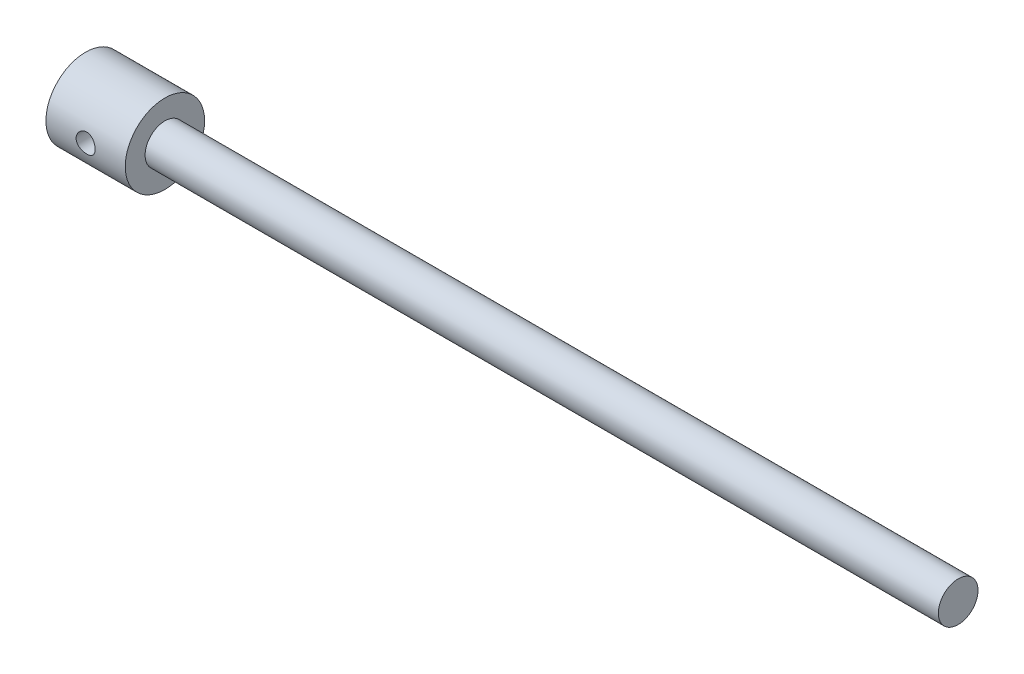
from build123d import *

# Parameters (mm, degrees)
SKETCH1_R           = 25
BOSS_EXTRUDE1_DEPTH = 50
SKETCH2_R           = 6
CUT_EXTRUDE1_DEPTH  = 35
SKETCH3_R           = 12.5
BOSS_EXTRUDE2_DEPTH = 500


with BuildPart() as part:
    # Sketch1 → Boss-Extrude1 (new body)
    with BuildSketch(Plane(origin=(0, 0, 0), x_dir=(0, 0, -1), z_dir=(1, 0, 0))):
        Circle(SKETCH1_R)
    extrude(amount=BOSS_EXTRUDE1_DEPTH)

    # Sketch2 → Cut-Extrude1 (cut, symmetric)
    with BuildSketch(Plane.XY):
        with Locations((25, 0)):
            Circle(SKETCH2_R)
    extrude(amount=CUT_EXTRUDE1_DEPTH, both=True, mode=Mode.SUBTRACT)

    # Sketch3 → Boss-Extrude2 (add)
    with BuildSketch(Plane(origin=(50, 0, 0), x_dir=(0, 0, -1), z_dir=(1, 0, 0))):
        Circle(SKETCH3_R)
    extrude(amount=BOSS_EXTRUDE2_DEPTH)


solid = part.part
